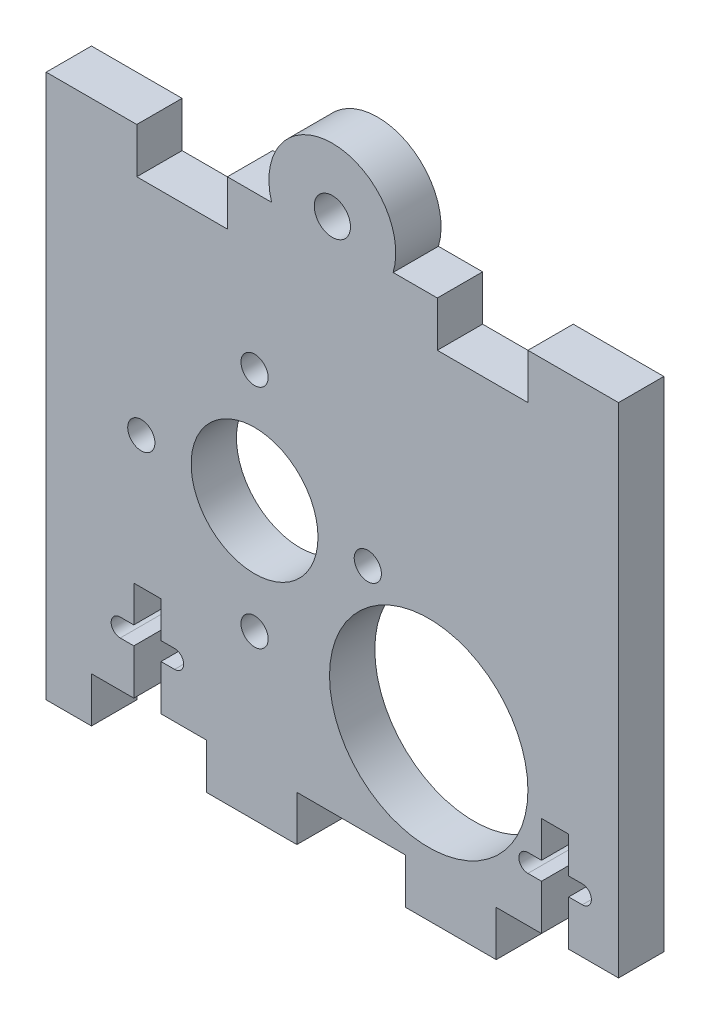
from build123d import *

# Parameters (mm, degrees)
SKETCH8_R           = 1.5
SKETCH8_R_2         = 7
SKETCH8_R_3         = 10.95
BOSS_EXTRUDE1_DEPTH = 5
SKETCH9_W           = 10
SKETCH9_H           = 5
SKETCH9_W_2         = 5
BOSS_EXTRUDE2_DEPTH = 5
SKETCH11_R          = 7
SKETCH11_R_2        = 2
SKETCH11_W          = 10
SKETCH11_H          = 5
BOSS_EXTRUDE4_DEPTH = 5
SKETCH11_2_W        = 10
SKETCH11_2_H        = 5
CUT_EXTRUDE1_DEPTH  = 5


with BuildPart() as part:
    # Sketch8 → Boss-Extrude1 (new body)
    with BuildSketch(Plane.XY):
        with BuildLine():
            Line((-31.585962214, 30.725), (-31.585962214, -24.275))
            Line((-31.585962214, -24.275), (-21.914037786, -24.275))
            Line((-21.914037786, -24.275), (-21.914037786, -19.275))
            Line((-21.914037786, -19.275), (-23.414037786, -19.275))
            ThreePointArc((-23.414037786, -19.275), (-24.414037786, -18.275), (-23.414037786, -17.275))
            Line((-23.414037786, -17.275), (-21.914037786, -17.275))
            Line((-21.914037786, -17.275), (-21.914037786, -13.275))
            Line((-21.914037786, -13.275), (-18.914037786, -13.275))
            Line((-18.914037786, -13.275), (-18.914037786, -17.275))
            Line((-18.914037786, -17.275), (-17.414037786, -17.275))
            ThreePointArc((-17.414037786, -17.275), (-16.414037786, -18.275), (-17.414037786, -19.275))
            Line((-17.414037786, -19.275), (-18.914037786, -19.275))
            Line((-18.914037786, -19.275), (-18.914037786, -24.275))
            Line((-18.914037786, -24.275), (21.585962214, -24.275))
            Line((21.585962214, -24.275), (23.085962214, -24.275))
            Line((23.085962214, -24.275), (23.085962214, -19.275))
            Line((23.085962214, -19.275), (21.585962214, -19.275))
            ThreePointArc((21.585962214, -19.275), (20.585962214, -18.275), (21.585962214, -17.275))
            Line((21.585962214, -17.275), (23.085962214, -17.275))
            Line((23.085962214, -17.275), (23.085962214, -13.275))
            Line((23.085962214, -13.275), (26.085962214, -13.275))
            Line((26.085962214, -13.275), (26.085962214, -17.275))
            Line((26.085962214, -17.275), (27.585962214, -17.275))
            ThreePointArc((27.585962214, -17.275), (28.585962214, -18.275), (27.585962214, -19.275))
            Line((27.585962214, -19.275), (26.085962214, -19.275))
            Line((26.085962214, -19.275), (26.085962214, -24.275))
            Line((26.085962214, -24.275), (31.585962214, -24.275))
            Line((31.585962214, -24.275), (31.585962214, -9.275))
            ThreePointArc((31.585962214, -9.275), (19.870233462, 19.009271247), (-8.414037786, 30.725))
            Line((-8.414037786, 30.725), (-18.914037786, 30.725))
            Line((-18.914037786, 30.725), (-18.914037786, 25.725))
            Line((-18.914037786, 25.725), (-17.414037786, 25.725))
            ThreePointArc((-17.414037786, 25.725), (-16.414037786, 24.725), (-17.414037786, 23.725))
            Line((-17.414037786, 23.725), (-18.914037786, 23.725))
            Line((-18.914037786, 23.725), (-18.914037786, 19.725))
            Line((-18.914037786, 19.725), (-21.914037786, 19.725))
            Line((-21.914037786, 19.725), (-21.914037786, 23.725))
            Line((-21.914037786, 23.725), (-23.414037786, 23.725))
            ThreePointArc((-23.414037786, 23.725), (-24.414037786, 24.725), (-23.414037786, 25.725))
            Line((-23.414037786, 25.725), (-21.914037786, 25.725))
            Line((-21.914037786, 25.725), (-21.914037786, 30.725))
            Line((-21.914037786, 30.725), (-31.585962214, 30.725))
        make_face()
        with Locations((-8.585962214, -11.225)):
            Circle(SKETCH8_R, mode=Mode.SUBTRACT)
        with Locations((-21.085962214, 1.275)):
            Circle(SKETCH8_R, mode=Mode.SUBTRACT)
        with Locations((-8.585962214, 1.275)):
            Circle(SKETCH8_R_2, mode=Mode.SUBTRACT)
        with Locations((10.635962214, -11.325)):
            Circle(SKETCH8_R_3, mode=Mode.SUBTRACT)
        with Locations((3.914037786, 1.275)):
            Circle(SKETCH8_R, mode=Mode.SUBTRACT)
        with Locations((-8.585962214, 13.775)):
            Circle(SKETCH8_R, mode=Mode.SUBTRACT)
    extrude(amount=BOSS_EXTRUDE1_DEPTH)

    # Sketch9 → Boss-Extrude2 (add)
    with BuildSketch(Plane(origin=(0, 0, 0), x_dir=(-1, 0, 0), z_dir=(0, 0, -1))):
        with Locations((-13.085962214, -26.775)):
            Rectangle(SKETCH9_W, SKETCH9_H)
        with Locations((8.914037786, -26.775)):
            Rectangle(SKETCH9_W, SKETCH9_H)
        with BuildLine():
            Line((31.585962214, 30.725), (-31.585962214, 30.725))
            Line((-31.585962214, 30.725), (-31.585962214, 11.746641407))
            Line((-31.585962214, 11.746641407), (-31.585962214, -2.994966805))
            Line((-31.585962214, -2.994966805), (-31.585962214, -9.275))
            Line((-31.585962214, -9.275), (-26.161018226, -9.275))
            Line((-26.161018226, -9.275), (-26.161018226, -2.994966805))
            Line((-26.161018226, -2.994966805), (-17.743215339, -2.994966805))
            Line((-17.743215339, -2.994966805), (-17.743215339, 11.746641407))
            Line((-17.743215339, 11.746641407), (6.40967317, 11.746641407))
            ThreePointArc((6.40967317, 11.746641407), (8.585962214, 16.749974384), (10.762251258, 11.746641407))
            Line((10.762251258, 11.746641407), (31.585962214, 11.746641407))
            Line((31.585962214, 11.746641407), (31.585962214, 30.725))
        make_face()
        with Locations((29.085962214, -26.775)):
            Rectangle(SKETCH9_W_2, SKETCH9_H)
    extrude(amount=-BOSS_EXTRUDE2_DEPTH)

    # Sketch11 → Boss-Extrude4 (add)
    # profile 1 of 3: a face of its own
    with BuildSketch(Plane.XY.offset(5)):
        with Locations((0, 32.725)):
            Circle(SKETCH11_R)
        with Locations((0, 32.725)):
            Circle(SKETCH11_R_2, mode=Mode.SUBTRACT)
    # profile 2 of 3: a face of its own
    with BuildSketch(Plane.XY.offset(5)):
        with Locations((-16.585962214, 28.225)):
            Rectangle(SKETCH11_W, SKETCH11_H)
    # profile 3 of 3: a face of its own
    with BuildSketch(Plane.XY.offset(5)):
        with Locations((16.585962214, 28.225)):
            Rectangle(SKETCH11_W, SKETCH11_H)
    extrude(amount=-BOSS_EXTRUDE4_DEPTH)

    # Sketch11<2> → Cut-Extrude1 (cut)
    with BuildSketch(Plane.XY.offset(5)):
        with Locations((16.585962214, 28.225)):
            Rectangle(SKETCH11_2_W, SKETCH11_2_H)
        with Locations((-16.585962214, 28.225)):
            Rectangle(SKETCH11_2_W, SKETCH11_2_H)
    extrude(amount=-CUT_EXTRUDE1_DEPTH, mode=Mode.SUBTRACT)


solid = part.part
